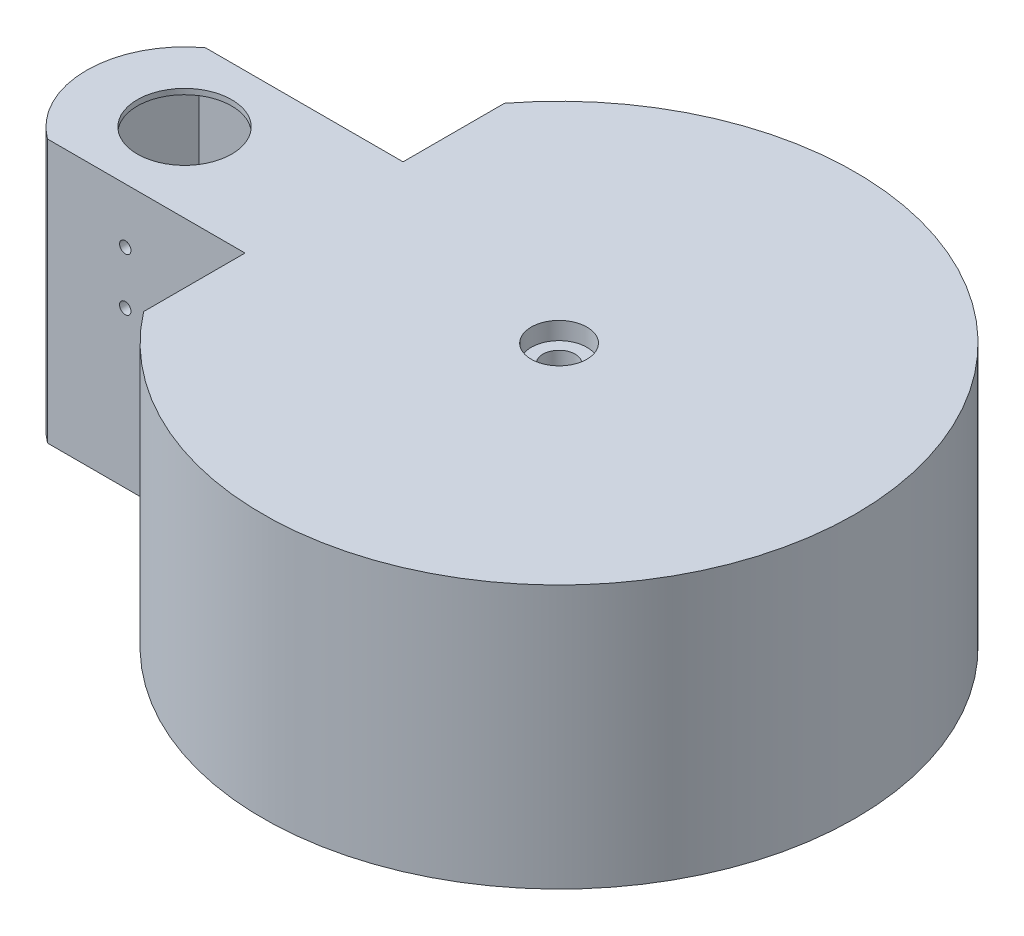
from build123d import *

# Parameters (mm, degrees)
ESQUISSE1_R             = 10.75
ESQUISSE1_R_2           = 3.675
BOSS_EXTRU_1_DEPTH      = 60
ESQUISSE2_W             = 50
ESQUISSE2_H             = 29
ENL_V_MAT_EXTRU_1_DEPTH = 58.75
D_GAGEMENT_M21_D        = 2.6
ESQUISSE4_R             = 6.35
ENL_V_MAT_EXTRU_2_DEPTH = 4
ENL_V_START             = -4
ESQUISSE5_R             = 6.35
ENL_V_MAT_EXTRU_3_DEPTH = 4


with BuildPart() as part:
    # Esquisse1 → Boss.-Extru.1 (new body)
    with BuildSketch(Plane(origin=(0, 0, 0), x_dir=(1, 0, 0), z_dir=(0, 1, 0))):
        with BuildLine():
            Line((-53.54472285, -18), (-53.54472285, -41.100032298))
            ThreePointArc((-53.54472285, -41.100032298), (67.5, 0), (-53.54472285, 41.100032298))
            Line((-53.54472285, 41.100032298), (-53.54472285, 18))
            Line((-53.54472285, 18), (-98.54472285, 18))
            ThreePointArc((-98.54472285, 18), (-107.66, 0), (-98.54472285, -18))
            Line((-98.54472285, -18), (-53.54472285, -18))
        make_face()
        with Locations(Location((-85.33, 0, 0), (0, 0, 270))):
            Circle(ESQUISSE1_R, mode=Mode.SUBTRACT)
        with Locations(Location((0, 0, 0), (0, 0, 270))):
            Circle(ESQUISSE1_R_2, mode=Mode.SUBTRACT)
    extrude(amount=BOSS_EXTRU_1_DEPTH)

    # Esquisse2 → Enlèv. mat.-Extru.1 (cut)
    with BuildSketch(Plane.XZ):
        with Locations((-71.58, 0)):
            Rectangle(ESQUISSE2_W, ESQUISSE2_H)
    extrude(amount=-ENL_V_MAT_EXTRU_1_DEPTH, mode=Mode.SUBTRACT)

    # Dégagement M21 (through all)
    with Locations(Plane(origin=(-56.83, 47.5, -18), x_dir=(-1, 0, 0), z_dir=(0, 0, -1))):
        with Locations((0, 0), (24, 0), (24, -12), (0, -12)):
            Hole(D_GAGEMENT_M21_D / 2)

    # Esquisse4 → Enlèv. mat.-Extru.2 (cut)
    with BuildSketch(Plane.XZ):
        with Locations(Location((0, 0, 0), (0, 0, 270))):
            Circle(ESQUISSE4_R)
    extrude(amount=-ENL_V_MAT_EXTRU_2_DEPTH, mode=Mode.SUBTRACT)

    # Esquisse5 → Enlèv. mat.-Extru.3 (cut)
    with BuildSketch(Plane(origin=(0, 60, 0), x_dir=(1, 0, 0), z_dir=(0, 1, 0)).offset(ENL_V_START)):
        with Locations(Location((0, 0, 0), (0, 0, 90))):
            Circle(ESQUISSE5_R)
    extrude(amount=ENL_V_MAT_EXTRU_3_DEPTH, mode=Mode.SUBTRACT)


solid = part.part
